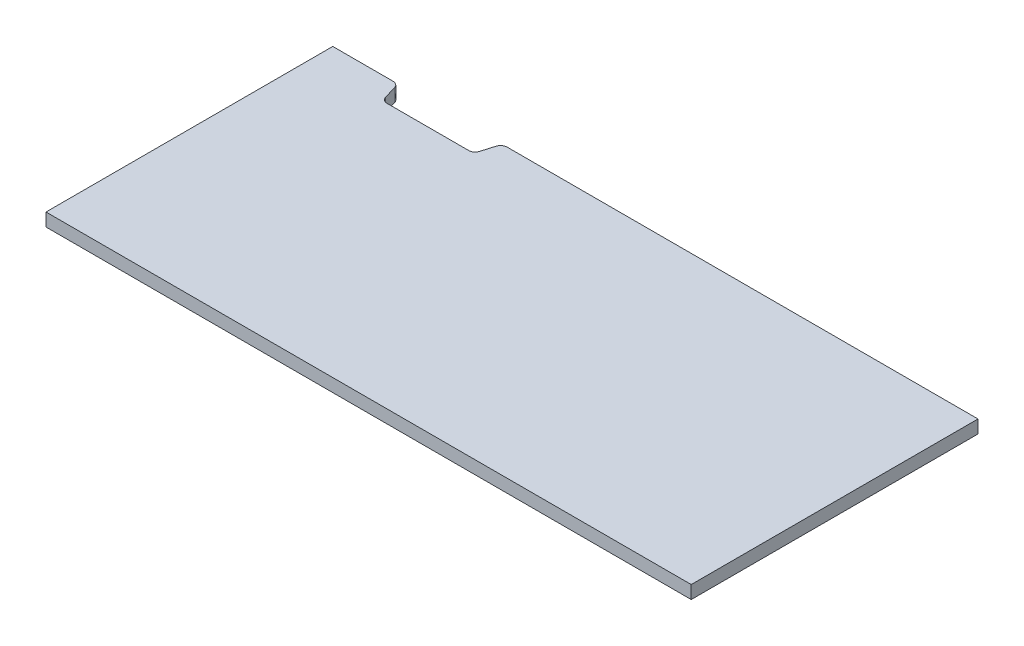
from build123d import *

# Parameters (mm, degrees)
SKETCH1_W           = 628.65
SKETCH1_H           = 279.4
BOSS_EXTRUDE1_DEPTH = 12.7
CUT_EXTRUDE1_DEPTH  = 345.20573154
FILLET1_R           = 6.35


with BuildPart() as part:
    # Sketch1 → Boss-Extrude1 (new body)
    with BuildSketch(Plane(origin=(0, 0, 0), x_dir=(1, 0, 0), z_dir=(0, 1, 0))):
        Rectangle(SKETCH1_W, SKETCH1_H)
    extrude(amount=BOSS_EXTRUDE1_DEPTH)

    # Sketch2 → Cut-Extrude1 (cut, through all)
    with BuildSketch(Plane.XZ):
        Polygon((-149.225, -139.7), (-250.825, -139.7), (-244.475, -118.11), (-155.575, -118.11), align=None)
    extrude(amount=-CUT_EXTRUDE1_DEPTH, mode=Mode.SUBTRACT)

    # Fillet1
    fillet1_edges = [part.edges().sort_by_distance(p)[0] for p in [
        (-155.575, 6.35, -118.11),
        (-149.225, 6.35, -139.7),
        (-250.825, 6.35, -139.7),
        (-244.475, 6.35, -118.11),
    ]]
    fillet(fillet1_edges, radius=FILLET1_R)


solid = part.part
